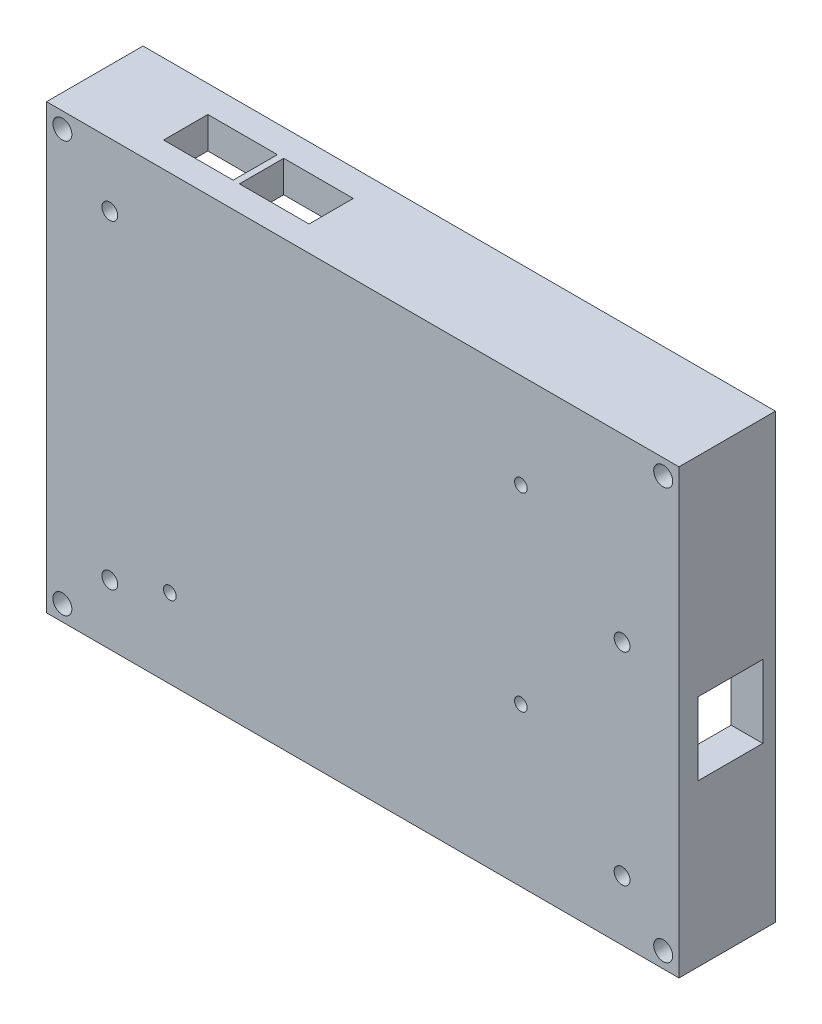
from build123d import *

# Parameters (mm, degrees)
SKETCH1_W           = 100
SKETCH1_H           = 70
SKETCH1_R           = 1.5
SKETCH1_R_2         = 1.25
SKETCH1_R_3         = 1
BOSS_EXTRUDE6_DEPTH = 2
BOSS_EXTRUDE7_START = -7
SKETCH1_16_W        = 100
SKETCH1_16_H        = 70
SKETCH1_16_R        = 1.5
SKETCH1_16_W_2      = 90
SKETCH1_16_H_2      = 60
SKETCH1_16_W_3      = 8
SKETCH1_16_H_3      = 7
SKETCH1_16_R_2      = 1.75
SKETCH1_16_W_4      = 7.5
SKETCH1_16_H_4      = 8
SKETCH1_16_W_5      = 8.5
SKETCH1_16_H_5      = 8.5
SKETCH1_16_R_3      = 1.25
SKETCH1_16_R_4      = 0.625
BOSS_EXTRUDE7_DEPTH = 7
SKETCH1_18_W        = 10
SKETCH1_18_H        = 6
BOSS_EXTRUDE8_DEPTH = 5.5
CUT_EXTRUDE2_START  = -5.75
SKETCH1_19_R        = 1.25
SKETCH1_19_R_2      = 0.625
CUT_EXTRUDE2_DEPTH  = 5.75
BOSS_EXTRUDE9_START = -13.25
SKETCH1_20_W        = 100
SKETCH1_20_H        = 70
SKETCH1_20_R        = 1.5
SKETCH1_20_W_2      = 90
SKETCH1_20_H_2      = 60
BOSS_EXTRUDE9_DEPTH = 13.25
SKETCH4_W           = 10.25
SKETCH4_H           = 11.5
CUT_EXTRUDE3_DEPTH  = 5
SKETCH5_W           = 3.75
SKETCH5_H           = 8.5
CUT_EXTRUDE4_DEPTH  = 5
SKETCH6_W           = 11
SKETCH6_H           = 7
CUT_EXTRUDE5_DEPTH  = 5


with BuildPart() as part:
    # Sketch1 → Boss-Extrude6 (new body)
    with BuildSketch(Plane.XY):
        with Locations((50, 35)):
            Rectangle(SKETCH1_W, SKETCH1_H)
        with Locations((2.5, 2.5)):
            Circle(SKETCH1_R, mode=Mode.SUBTRACT)
        with Locations((2.5, 67.5)):
            Circle(SKETCH1_R, mode=Mode.SUBTRACT)
        with Locations((97.5, 67.5)):
            Circle(SKETCH1_R, mode=Mode.SUBTRACT)
        with Locations((97.5, 2.5)):
            Circle(SKETCH1_R, mode=Mode.SUBTRACT)
        with Locations((10, 9.5)):
            Circle(SKETCH1_R_2, mode=Mode.SUBTRACT)
        with Locations((10, 60)):
            Circle(SKETCH1_R_2, mode=Mode.SUBTRACT)
        with Locations((91, 41.5)):
            Circle(SKETCH1_R_2, mode=Mode.SUBTRACT)
        with Locations((91, 9.5)):
            Circle(SKETCH1_R_2, mode=Mode.SUBTRACT)
        with Locations((19.5, 12.5)):
            Circle(SKETCH1_R_3, mode=Mode.SUBTRACT)
        with Locations((75, 55)):
            Circle(SKETCH1_R_3, mode=Mode.SUBTRACT)
        with Locations((75, 25)):
            Circle(SKETCH1_R_3, mode=Mode.SUBTRACT)
    extrude(amount=BOSS_EXTRUDE6_DEPTH)

    # Sketch1<16> → Boss-Extrude7 (add)
    # profile 1 of 13: a face of its own
    with BuildSketch(Plane.XY.offset(BOSS_EXTRUDE7_START)):
        with Locations((50, 35)):
            Rectangle(SKETCH1_16_W, SKETCH1_16_H)
        with Locations((97.5, 2.5)):
            Circle(SKETCH1_16_R, mode=Mode.SUBTRACT)
        with Locations((97.5, 67.5)):
            Circle(SKETCH1_16_R, mode=Mode.SUBTRACT)
        with Locations((2.5, 67.5)):
            Circle(SKETCH1_16_R, mode=Mode.SUBTRACT)
        with Locations((2.5, 2.5)):
            Circle(SKETCH1_16_R, mode=Mode.SUBTRACT)
        with Locations((50, 35)):
            Rectangle(SKETCH1_16_W_2, SKETCH1_16_H_2, mode=Mode.SUBTRACT)
    # profile 2 of 13: a face of its own
    with BuildSketch(Plane.XY.offset(BOSS_EXTRUDE7_START)):
        with Locations((9, 8.5)):
            Rectangle(SKETCH1_16_W_3, SKETCH1_16_H_3)
        with Locations((10, 9.5)):
            Circle(SKETCH1_16_R_2, mode=Mode.SUBTRACT)
    # profile 3 of 13: a face of its own
    with BuildSketch(Plane.XY.offset(BOSS_EXTRUDE7_START)):
        with Locations((91.25, 9)):
            Rectangle(SKETCH1_16_W_4, SKETCH1_16_H_4)
        with Locations((91, 9.5)):
            Circle(SKETCH1_16_R_2, mode=Mode.SUBTRACT)
    # profile 4 of 13: a face of its own
    with BuildSketch(Plane.XY.offset(BOSS_EXTRUDE7_START)):
        with Locations((91.25, 41.5)):
            Rectangle(SKETCH1_16_W_4, SKETCH1_16_H_3)
        with Locations((91, 41.5)):
            Circle(SKETCH1_16_R_2, mode=Mode.SUBTRACT)
    # profile 5 of 13: a face of its own
    with BuildSketch(Plane.XY.offset(BOSS_EXTRUDE7_START)):
        with Locations((9.25, 60.75)):
            Rectangle(SKETCH1_16_W_5, SKETCH1_16_H_5)
        with Locations((10, 60)):
            Circle(SKETCH1_16_R_2, mode=Mode.SUBTRACT)
    # profile 6 of 13: a face of its own
    with BuildSketch(Plane.XY.offset(BOSS_EXTRUDE7_START)):
        with Locations((10, 60)):
            Circle(SKETCH1_16_R_2)
        with Locations((10, 60)):
            Circle(SKETCH1_16_R_3, mode=Mode.SUBTRACT)
    # profile 7 of 13: a face of its own
    with BuildSketch(Plane.XY.offset(BOSS_EXTRUDE7_START)):
        with Locations((10, 60)):
            Circle(SKETCH1_16_R_3)
        with Locations((10, 60)):
            Circle(SKETCH1_16_R_4, mode=Mode.SUBTRACT)
    # profile 8 of 13: a face of its own
    with BuildSketch(Plane.XY.offset(BOSS_EXTRUDE7_START)):
        with Locations((10, 9.5)):
            Circle(SKETCH1_16_R_2)
        with Locations((10, 9.5)):
            Circle(SKETCH1_16_R_3, mode=Mode.SUBTRACT)
    # profile 9 of 13: a face of its own
    with BuildSketch(Plane.XY.offset(BOSS_EXTRUDE7_START)):
        with Locations((10, 9.5)):
            Circle(SKETCH1_16_R_3)
        with Locations((10, 9.5)):
            Circle(SKETCH1_16_R_4, mode=Mode.SUBTRACT)
    # profile 10 of 13: a face of its own
    with BuildSketch(Plane.XY.offset(BOSS_EXTRUDE7_START)):
        with Locations((91, 9.5)):
            Circle(SKETCH1_16_R_2)
        with Locations((91, 9.5)):
            Circle(SKETCH1_16_R_3, mode=Mode.SUBTRACT)
    # profile 11 of 13: a face of its own
    with BuildSketch(Plane.XY.offset(BOSS_EXTRUDE7_START)):
        with Locations((91, 9.5)):
            Circle(SKETCH1_16_R_3)
        with Locations((91, 9.5)):
            Circle(SKETCH1_16_R_4, mode=Mode.SUBTRACT)
    # profile 12 of 13: a face of its own
    with BuildSketch(Plane.XY.offset(BOSS_EXTRUDE7_START)):
        with Locations((91, 41.5)):
            Circle(SKETCH1_16_R_2)
        with Locations((91, 41.5)):
            Circle(SKETCH1_16_R_3, mode=Mode.SUBTRACT)
    # profile 13 of 13: a face of its own
    with BuildSketch(Plane.XY.offset(BOSS_EXTRUDE7_START)):
        with Locations((91, 41.5)):
            Circle(SKETCH1_16_R_3)
        with Locations((91, 41.5)):
            Circle(SKETCH1_16_R_4, mode=Mode.SUBTRACT)
    extrude(amount=BOSS_EXTRUDE7_DEPTH)

    # Sketch1<18> → Boss-Extrude8 (add)
    with BuildSketch(Plane.XY):
        Polygon((19.5, 32.5), (19.5, 57.5), (70.5, 57.5), (70.5, 27.5), (52.5, 27.5), (52.5, 12.5), (32.5, 12.5), (32.5, 32.5), align=None)
        with Locations((49.5, 49)):
            Rectangle(SKETCH1_18_W, SKETCH1_18_H, mode=Mode.SUBTRACT)
    extrude(amount=-BOSS_EXTRUDE8_DEPTH)

    # Sketch1<19> → Cut-Extrude2 (cut)
    # profile 1 of 4: a face of its own
    with BuildSketch(Plane.XY.offset(CUT_EXTRUDE2_START)):
        with Locations((10, 60)):
            Circle(SKETCH1_19_R)
        with Locations((10, 60)):
            Circle(SKETCH1_19_R_2, mode=Mode.SUBTRACT)
    # profile 2 of 4: a face of its own
    with BuildSketch(Plane.XY.offset(CUT_EXTRUDE2_START)):
        with Locations((10, 9.5)):
            Circle(SKETCH1_19_R)
        with Locations((10, 9.5)):
            Circle(SKETCH1_19_R_2, mode=Mode.SUBTRACT)
    # profile 3 of 4: a face of its own
    with BuildSketch(Plane.XY.offset(CUT_EXTRUDE2_START)):
        with Locations((91, 9.5)):
            Circle(SKETCH1_19_R)
        with Locations((91, 9.5)):
            Circle(SKETCH1_19_R_2, mode=Mode.SUBTRACT)
    # profile 4 of 4: a face of its own
    with BuildSketch(Plane.XY.offset(CUT_EXTRUDE2_START)):
        with Locations((91, 41.5)):
            Circle(SKETCH1_19_R)
        with Locations((91, 41.5)):
            Circle(SKETCH1_19_R_2, mode=Mode.SUBTRACT)
    extrude(amount=CUT_EXTRUDE2_DEPTH, mode=Mode.SUBTRACT)

    # Sketch1<20> → Boss-Extrude9 (add)
    with BuildSketch(Plane.XY.offset(BOSS_EXTRUDE9_START)):
        with Locations((50, 35)):
            Rectangle(SKETCH1_20_W, SKETCH1_20_H)
        with Locations((97.5, 2.5)):
            Circle(SKETCH1_20_R, mode=Mode.SUBTRACT)
        with Locations((97.5, 67.5)):
            Circle(SKETCH1_20_R, mode=Mode.SUBTRACT)
        with Locations((2.5, 67.5)):
            Circle(SKETCH1_20_R, mode=Mode.SUBTRACT)
        with Locations((2.5, 2.5)):
            Circle(SKETCH1_20_R, mode=Mode.SUBTRACT)
        with Locations((50, 35)):
            Rectangle(SKETCH1_20_W_2, SKETCH1_20_H_2, mode=Mode.SUBTRACT)
    extrude(amount=BOSS_EXTRUDE9_DEPTH)

    # Sketch4 → Cut-Extrude3 (cut)
    with BuildSketch(Plane(origin=(100, 0, 0), x_dir=(0, 0, -1), z_dir=(1, 0, 0))):
        with Locations((6.125, 31.25)):
            Rectangle(SKETCH4_W, SKETCH4_H)
    extrude(amount=-CUT_EXTRUDE3_DEPTH, mode=Mode.SUBTRACT)

    # Sketch5 → Cut-Extrude4 (cut)
    with BuildSketch(Plane.ZY):
        with Locations((-6.5, 18)):
            Rectangle(SKETCH5_W, SKETCH5_H)
    extrude(amount=-CUT_EXTRUDE4_DEPTH, mode=Mode.SUBTRACT)

    # Sketch6 → Cut-Extrude5 (cut)
    with BuildSketch(Plane(origin=(0, 70, 0), x_dir=(1, 0, 0), z_dir=(0, 1, 0))):
        with Locations((20, 5.5)):
            Rectangle(SKETCH6_W, SKETCH6_H)
        with Locations((32, 5.5)):
            Rectangle(SKETCH6_W, SKETCH6_H)
    extrude(amount=-CUT_EXTRUDE5_DEPTH, mode=Mode.SUBTRACT)


solid = part.part
